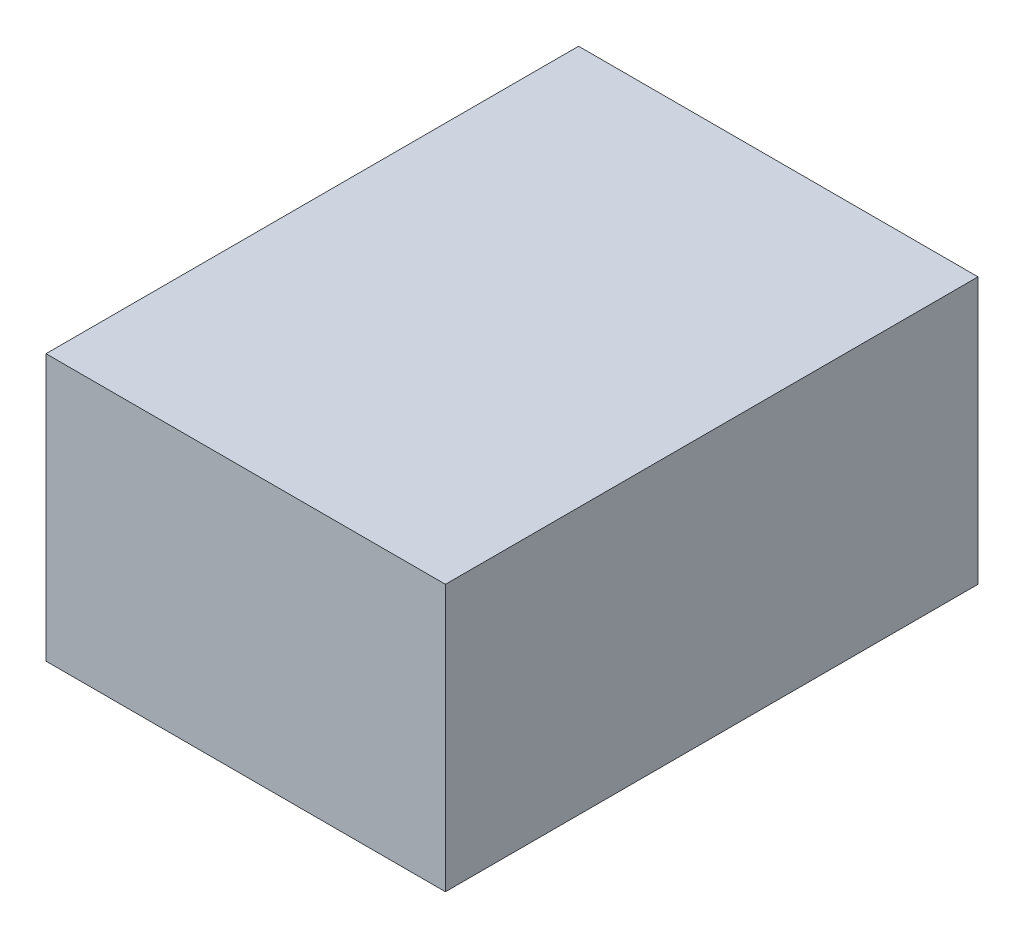
from build123d import *

# Parameters (mm, degrees)
SKETCH_1_W          = 300
SKETCH_1_H          = 200
EXTRUDE_1_DEPTH     = 200
SKETCH_2_W          = 19.471153846
SKETCH_2_H          = 15.044070513
CUT_EXTRUDE_1_DEPTH = 1


with BuildPart() as part:
    # 草图1 → 凸台-拉伸1 (new, symmetric)
    with BuildSketch(Plane.XY):
        Rectangle(SKETCH_1_W, SKETCH_1_H)
    extrude(amount=EXTRUDE_1_DEPTH, both=True)

    # 草图2 → 切除-拉伸1 (cut)
    # profile 1 of 11: a face of its own
    with BuildSketch(Plane.ZY.offset(150)):
        with BuildLine():
            Line((-75.450721154, -9.787660256), (-51.652644231, -9.787660256))
            Line((-51.652644231, -9.787660256), (-48.407451923, -6.542467949))
            Line((-48.407451923, -6.542467949), (-43.539663462, -11.41025641))
            Line((-43.539663462, -11.41025641), (-58.413461538, -11.41025641))
            Line((-58.413461538, -11.41025641), (-58.413461538, -29.659455128))
            Line((-58.413461538, -29.659455128), (-46.243990385, -29.659455128))
            Line((-46.243990385, -29.659455128), (-42.728365385, -26.143830128))
            Line((-42.728365385, -26.143830128), (-37.590144231, -31.282051282))
            Line((-37.590144231, -31.282051282), (-71.935096154, -31.282051282))
            add(Edge.make_bspline(
                [(-71.935096154, -31.282051282), (-72.509677745, -31.291432943), (-73.637496074, -31.309847751), (-75.297671202, -31.461870865), (-76.890613511, -31.718813935), (-77.919410993, -31.969859163), (-78.425480769, -32.093349359)],
                knots=[0, 0, 0, 0, 1.051078301, 2.063110603, 3.047236021, 4, 4, 4, 4], degree=3))
            Line((-78.425480769, -32.093349359), (-80.859375, -29.659455128))
            Line((-80.859375, -29.659455128), (-62.199519231, -29.659455128))
            Line((-62.199519231, -29.659455128), (-62.199519231, -11.41025641))
            Line((-62.199519231, -11.41025641), (-70.3125, -11.41025641))
            Line((-70.3125, -11.41025641), (-73.287259615, -11.951121795))
            Line((-73.287259615, -11.951121795), (-75.450721154, -9.787660256))
        make_face()
    # profile 2 of 11: a face of its own
    with BuildSketch(Plane.ZY.offset(150)):
        with BuildLine():
            add(Edge.make_bspline(
                [(-63.010817308, 3.313301282), (-63.70196555, 2.665342126), (-65.055789436, 1.396117192), (-67.101920987, -0.409024252), (-69.110744006, -2.081594188), (-71.088024242, -3.618739462), (-73.031231691, -5.023676297), (-74.94109794, -6.295252031), (-76.816370054, -7.437215951), (-78.078317117, -8.107473192), (-78.695913462, -8.435496795)],
                knots=[0, 0, 0, 0, 1.156336434, 2.26503634, 3.329987673, 4.346491992, 5.321449847, 6.25617807, 7.146574306, 8, 8, 8, 8], degree=3))
            Line((-78.695913462, -8.435496795), (-79.236778846, -7.634214744))
            add(Edge.make_bspline(
                [(-79.236778846, -7.634214744), (-78.466612119, -7.013211807), (-76.94716156, -5.788044287), (-74.798431552, -3.862344293), (-72.786159979, -1.907681593), (-70.9283371, 0.087261462), (-69.193348519, 2.098242314), (-67.624658478, 4.158001254), (-66.177926926, 6.239812834), (-65.326128482, 7.678293836), (-64.903846154, 8.391426282)],
                knots=[0, 0, 0, 0, 1.097558762, 2.165357468, 3.200105271, 4.20915088, 5.189137413, 6.145661431, 7.080704579, 8, 8, 8, 8], degree=3))
            Line((-64.903846154, 8.391426282), (-60.306490385, 4.114583333))
            Line((-60.306490385, 4.114583333), (-63.010817308, 3.313301282))
        make_face()
    # profile 3 of 11: a face of its own
    with BuildSketch(Plane.ZY.offset(150)):
        with BuildLine():
            Line((-56.790865385, 5.426682692), (-56.25, 6.227964744))
            add(Edge.make_bspline(
                [(-56.25, 6.227964744), (-55.602013201, 5.968288295), (-54.353765393, 5.468061196), (-52.561921114, 4.736310179), (-50.939784526, 4.014935701), (-49.466067329, 3.364571381), (-48.159257951, 2.734189121), (-47.020604624, 2.126839151), (-46.023607961, 1.588926724), (-45.188639348, 1.056551314), (-44.475056656, 0.550255631), (-43.856984613, 0.050625612), (-43.336392245, -0.461096037), (-42.895700421, -0.97242665), (-42.557197401, -1.498201373), (-42.283675047, -2.019424407), (-42.126252176, -2.557957207), (-42.025171716, -3.246440506), (-42.036704675, -4.053274649), (-42.150719623, -4.932592671), (-42.419038065, -5.69226447), (-42.834698578, -6.278936389), (-43.261573998, -6.718303712), (-43.600840751, -7.050337487), (-43.852393158, -7.27820396), (-44.018844643, -7.333335264), (-44.080528846, -7.353766026)],
                knots=[0, 0, 0, 0, 2.222387381, 4.281090571, 6.16104692, 7.873717546, 9.409149256, 10.778394997, 11.982114518, 13.014137748, 13.928452118, 14.766772039, 15.540917158, 16.249939126, 16.910287843, 17.528216072, 18.116646233, 18.686347911, 19.738588089, 20.67355028, 21.50081465, 22.273206655, 22.942476537, 23.446079015, 23.794725926, 24, 24, 24, 24], degree=3))
            add(Edge.make_bspline(
                [(-44.080528846, -7.353766026), (-44.175859193, -7.343044478), (-44.380619318, -7.320015658), (-44.678917095, -7.144088262), (-44.998614522, -6.89875826), (-45.316223469, -6.529817279), (-45.665278329, -6.085597905), (-46.027524829, -5.534711555), (-46.405001357, -4.884293922), (-46.653226834, -4.410106054), (-46.784855769, -4.158653846)],
                knots=[0, 0, 0, 0, 0.527544467, 1.133113159, 1.886286847, 2.76587534, 3.823244141, 5.026973888, 6.423464563, 8, 8, 8, 8], degree=3))
            add(Edge.make_bspline(
                [(-46.784855769, -4.158653846), (-46.989047869, -3.814065973), (-47.420787522, -3.085476333), (-48.239652361, -2.011437907), (-49.229647584, -0.886631945), (-50.400133133, 0.283507751), (-51.736166033, 1.511385737), (-53.262058618, 2.773753173), (-54.955406846, 4.101113011), (-56.163369895, 4.973504929), (-56.790865385, 5.426682692)],
                knots=[0, 0, 0, 0, 0.688371872, 1.455479582, 2.318090961, 3.264097909, 4.300380693, 5.437681015, 6.668962925, 8, 8, 8, 8], degree=3))
        make_face()
    # profile 4 of 11: a face of its own
    with BuildSketch(Plane.ZY.offset(150)):
        with BuildLine():
            Line((-47.325721154, 5.446714744), (-44.891826923, 11.666666667))
            Line((-44.891826923, 11.666666667), (-72.205528846, 11.666666667))
            add(Edge.make_bspline(
                [(-72.205528846, 11.666666667), (-72.209545167, 11.279296402), (-72.217131374, 10.547614202), (-72.268562392, 9.505548418), (-72.342238873, 8.581714154), (-72.457335153, 7.773120501), (-72.627824299, 7.066031142), (-72.963412456, 6.490892686), (-73.401577134, 6.016481735), (-73.955281564, 5.712724387), (-74.493605098, 5.479308102), (-74.980823455, 5.327392286), (-75.374003207, 5.196892528), (-75.616967012, 5.182467666), (-75.721153846, 5.176282051)],
                knots=[0, 0, 0, 0, 1.659337105, 3.134229793, 4.469274937, 5.626275952, 6.636097599, 7.558581424, 8.448790264, 9.366159641, 10.237556677, 10.961212527, 11.554551027, 12, 12, 12, 12], degree=3))
            add(Edge.make_bspline(
                [(-75.721153846, 5.176282051), (-75.926977026, 5.200863862), (-76.398676686, 5.25719975), (-76.960801227, 5.507780864), (-77.402148443, 5.758829992), (-77.660400273, 5.930881929), (-77.838501226, 6.088857197), (-77.871346218, 6.209338958), (-77.884615385, 6.258012821)],
                knots=[0, 0, 0, 0, 1.48119583, 3.394562111, 4.36050321, 5.118249749, 5.643778524, 6, 6, 6, 6], degree=3))
            add(Edge.make_bspline(
                [(-77.884615385, 6.258012821), (-77.859171349, 6.417580582), (-77.79749553, 6.804369564), (-77.441174029, 7.405199141), (-76.941475815, 8.154965154), (-76.505565534, 8.672942155), (-76.262019231, 8.962339744)],
                knots=[0, 0, 0, 0, 0.602804915, 1.46118676, 2.581546234, 4, 4, 4, 4], degree=3))
            add(Edge.make_bspline(
                [(-76.262019231, 8.962339744), (-76.084382658, 9.196576078), (-75.721882707, 9.674578205), (-75.245623444, 10.45729072), (-74.813160733, 11.305417058), (-74.423295069, 12.219503302), (-74.073048646, 13.203164758), (-73.766630319, 14.254088874), (-73.489992251, 15.368698066), (-73.355942792, 16.139511816), (-73.287259615, 16.534455128)],
                knots=[0, 0, 0, 0, 0.857780197, 1.750457547, 2.670233957, 3.635223603, 4.649507386, 5.716600804, 6.830050396, 8, 8, 8, 8], degree=3))
            Line((-73.287259615, 16.534455128), (-72.205528846, 16.534455128))
            Line((-72.205528846, 16.534455128), (-72.205528846, 13.289262821))
            Line((-72.205528846, 13.289262821), (-44.891826923, 13.289262821))
            Line((-44.891826923, 13.289262821), (-42.728365385, 15.993589744))
            Line((-42.728365385, 15.993589744), (-38.401442308, 11.666666667))
            add(Edge.make_bspline(
                [(-38.401442308, 11.666666667), (-38.684354377, 11.642102561), (-39.278842727, 11.590485553), (-40.181290416, 11.248828137), (-41.121737421, 10.709676261), (-42.105858217, 9.949262777), (-43.146231281, 8.993311791), (-44.234615058, 7.823172057), (-45.377245387, 6.448093207), (-46.122434307, 5.437465723), (-46.514423077, 4.905849359)],
                knots=[0, 0, 0, 0, 0.624762377, 1.31282471, 2.108641581, 3.014257539, 4.053041353, 5.226914023, 6.54128459, 8, 8, 8, 8], degree=3))
            Line((-46.514423077, 4.905849359), (-47.325721154, 5.446714744))
        make_face()
    # profile 5 of 11: a face of its own
    with BuildSketch(Plane.ZY.offset(150)):
        with BuildLine():
            Line((-65.715144231, 23.966346154), (-65.174278846, 24.787660256))
            add(Edge.make_bspline(
                [(-65.174278846, 24.787660256), (-64.720112317, 24.587588037), (-63.84745463, 24.203159531), (-62.595153612, 23.646788285), (-61.460496178, 23.114337858), (-60.443133968, 22.614741677), (-59.535539849, 22.155492813), (-58.747094308, 21.722625205), (-58.062858127, 21.338660886), (-57.491118298, 20.971130105), (-57.004882612, 20.621727901), (-56.61479634, 20.245340599), (-56.281679404, 19.865029693), (-56.041759863, 19.45207644), (-55.879960122, 19.024950509), (-55.783226658, 18.582633626), (-55.777931626, 18.121375813), (-55.861986862, 17.514528961), (-56.047037646, 16.831415279), (-56.285523344, 16.120913458), (-56.568196031, 15.572602072), (-56.982235956, 15.112619977), (-57.503021253, 14.757853143), (-57.948790535, 14.676761108), (-58.143028846, 14.641426282)],
                knots=[0, 0, 0, 0, 1.971005274, 3.78718552, 5.442142868, 6.948379248, 8.288584754, 9.481213346, 10.520635333, 11.403371319, 12.180389358, 12.893209359, 13.55193343, 14.181869875, 14.777815506, 15.360333856, 15.970420313, 16.598679906, 17.7885781, 18.774169935, 19.5752527, 20.213920393, 21.22173846, 22, 22, 22, 22], degree=3))
            add(Edge.make_bspline(
                [(-58.143028846, 14.641426282), (-58.281974993, 14.670620993), (-58.602457106, 14.737959188), (-59.012182436, 15.159056904), (-59.405630128, 15.77512536), (-59.635732007, 16.279680672), (-59.765625, 16.564503205)],
                knots=[0, 0, 0, 0, 0.637804645, 1.47110939, 2.572435941, 4, 4, 4, 4], degree=3))
            add(Edge.make_bspline(
                [(-59.765625, 16.564503205), (-59.89309552, 16.803112562), (-60.165515822, 17.313050337), (-60.657759207, 18.088922378), (-61.253370857, 18.921714766), (-61.950493522, 19.812548005), (-62.735175214, 20.776707493), (-63.647731109, 21.779928888), (-64.63049822, 22.869734565), (-65.344837056, 23.591953831), (-65.715144231, 23.966346154)],
                knots=[0, 0, 0, 0, 0.681165141, 1.455734343, 2.312029879, 3.258982338, 4.304417023, 5.441970212, 6.673939121, 8, 8, 8, 8], degree=3))
        make_face()
    # profile 6 of 11: a face of its own
    with BuildSketch(Plane.ZY.offset(150)):
        with BuildLine():
            Line((-77.073317308, -1.344150641), (-85.997596154, -6.752804487))
            Line((-85.997596154, -6.752804487), (-85.997596154, -30.290464744))
            add(Edge.make_bspline(
                [(-85.997596154, -30.290464744), (-86.034019862, -30.642744359), (-86.105819984, -31.337174462), (-86.392147372, -32.342479048), (-86.832323572, -33.283432273), (-87.40391225, -34.170825289), (-88.131750366, -34.99086706), (-88.995220091, -35.751987297), (-90.008977617, -36.44585744), (-90.751140028, -36.844603946), (-91.135817308, -37.051282051)],
                knots=[0, 0, 0, 0, 0.951282364, 1.875212421, 2.79533767, 3.736905861, 4.704203426, 5.734873166, 6.825940502, 8, 8, 8, 8], degree=3))
            add(Edge.make_bspline(
                [(-91.135817308, -37.051282051), (-91.163025739, -36.79953398), (-91.220206246, -36.27046701), (-91.660060627, -35.514626358), (-92.342638066, -34.797134968), (-93.277495683, -34.08427096), (-94.464481398, -33.379256368), (-95.920512338, -32.699250749), (-97.623995282, -32.005798102), (-98.862156832, -31.591864124), (-99.519230769, -31.372195513)],
                knots=[0, 0, 0, 0, 0.567410724, 1.192455101, 1.93008711, 2.801753461, 3.841774178, 5.047670883, 6.433242804, 8, 8, 8, 8], degree=3))
            Line((-99.519230769, -31.372195513), (-99.519230769, -30.290464744))
            add(Edge.make_bspline(
                [(-99.519230769, -30.290464744), (-99.045341389, -30.375061439), (-98.138642048, -30.536921508), (-96.840643769, -30.75034827), (-95.667788187, -30.909130959), (-94.626098494, -31.031404794), (-93.711065449, -31.114159691), (-92.922505648, -31.155984562), (-92.256779012, -31.161386267), (-91.703259208, -31.120737514), (-91.22978333, -31.002108065), (-90.822460147, -30.766560946), (-90.503683226, -30.3944783), (-90.224950587, -29.937947908), (-90.035624757, -29.361567436), (-89.885065647, -28.687947638), (-89.798482348, -27.902114263), (-89.788799561, -27.342609539), (-89.783653846, -27.045272436)],
                knots=[0, 0, 0, 0, 1.808220358, 3.459693913, 4.940655569, 6.253580308, 7.399219139, 8.391232753, 9.218943302, 9.899057853, 10.471018597, 11.038839643, 11.633582565, 12.291719892, 13.037465463, 13.898517392, 14.883210947, 16, 16, 16, 16], degree=3))
            Line((-89.783653846, -27.045272436), (-89.783653846, -8.645833333))
            add(Edge.make_bspline(
                [(-89.783653846, -8.645833333), (-90.378604778, -8.991913183), (-91.505609913, -9.647486184), (-93.088394817, -10.591466608), (-94.455091648, -11.462800897), (-95.605537517, -12.253398503), (-96.55726479, -12.948128297), (-97.285806814, -13.569663064), (-97.836227203, -14.087288139), (-98.068567221, -14.451121966), (-98.167067308, -14.60536859)],
                knots=[0, 0, 0, 0, 1.596009153, 3.023292197, 4.273176395, 5.353314463, 6.260656545, 7.002131711, 7.576955733, 8, 8, 8, 8], degree=3))
            Line((-98.167067308, -14.60536859), (-101.412259615, -9.727564103))
            add(Edge.make_bspline(
                [(-101.412259615, -9.727564103), (-101.114404175, -9.649937782), (-100.460903896, -9.479624217), (-99.410362152, -9.14243811), (-98.200367401, -8.718923382), (-96.828090574, -8.217844081), (-95.29376289, -7.632877124), (-93.594081912, -6.977476087), (-91.739148303, -6.222335449), (-90.454180609, -5.682394881), (-89.783653846, -5.400641026)],
                knots=[0, 0, 0, 0, 0.594885919, 1.30519058, 2.131778393, 3.072962133, 4.12892683, 5.305816866, 6.59411104, 8, 8, 8, 8], degree=3))
            Line((-89.783653846, -5.400641026), (-89.783653846, 9.743589744))
            Line((-89.783653846, 9.743589744), (-95.462740385, 9.743589744))
            Line((-95.462740385, 9.743589744), (-98.707932692, 9.202724359))
            Line((-98.707932692, 9.202724359), (-100.871394231, 11.366185897))
            Line((-100.871394231, 11.366185897), (-89.783653846, 11.366185897))
            add(Edge.make_bspline(
                [(-89.783653846, 11.366185897), (-89.781657912, 12.16413824), (-89.777791236, 13.709992045), (-89.804795956, 15.953522225), (-89.82075086, 18.050280461), (-89.849747217, 20.003488977), (-89.894442704, 21.812870524), (-89.925763787, 23.476028778), (-89.991908399, 24.99142039), (-90.034042027, 25.952862937), (-90.054086538, 26.41025641)],
                knots=[0, 0, 0, 0, 1.272643643, 2.465461797, 3.57841033, 4.61688262, 5.580919197, 6.465104001, 7.269793692, 8, 8, 8, 8], degree=3))
            Line((-90.054086538, 26.41025641), (-83.293269231, 23.405448718))
            Line((-83.293269231, 23.405448718), (-85.997596154, 21.211939103))
            Line((-85.997596154, 21.211939103), (-85.997596154, 11.366185897))
            Line((-85.997596154, 11.366185897), (-83.834134615, 11.366185897))
            Line((-83.834134615, 11.366185897), (-81.129807692, 14.070512821))
            Line((-81.129807692, 14.070512821), (-76.802884615, 9.743589744))
            Line((-76.802884615, 9.743589744), (-85.997596154, 9.743589744))
            Line((-85.997596154, 9.743589744), (-85.997596154, -4.048477564))
            Line((-85.997596154, -4.048477564), (-77.614182692, -0.262419872))
            Line((-77.614182692, -0.262419872), (-77.073317308, -1.344150641))
        make_face()
    # profile 7 of 11: a face of its own
    with BuildSketch(Plane.ZY.offset(150)):
        with BuildLine():
            add(Edge.make_bspline(
                [(10.817307692, -21.095753205), (10.837451535, -20.588282839), (10.880253502, -19.510001523), (10.945816819, -17.797557633), (10.977223011, -15.8907371), (11.021781798, -13.794202363), (11.050804759, -11.507135627), (11.066485432, -9.029778816), (11.094447013, -6.362226635), (11.084306308, -3.554353152), (11.094395257, -0.716434405), (11.066014381, 2.054615289), (11.050556573, 4.702241831), (11.021196781, 7.226336136), (10.976236055, 9.626703859), (10.944824841, 11.904028871), (10.878017368, 14.060523245), (10.837153532, 15.456060568), (10.817307692, 16.133814103)],
                knots=[0, 0, 0, 0, 0.654692731, 1.391101799, 2.209012074, 3.112981841, 4.094341678, 5.15742433, 6.306581118, 7.533174739, 8.776983709, 9.964873981, 11.105423337, 12.19006718, 13.218828337, 14.200254234, 15.125939497, 16, 16, 16, 16], degree=3))
            Line((10.817307692, 16.133814103), (16.496394231, 13.419471154))
            Line((16.496394231, 13.419471154), (14.332932692, 11.786858974))
            Line((14.332932692, 11.786858974), (14.332932692, -13.213141026))
            add(Edge.make_bspline(
                [(14.332932692, -13.213141026), (14.33810291, -13.570420178), (14.349558248, -14.362021886), (14.405236136, -15.670779173), (14.481772165, -17.217093882), (14.560997979, -18.328129625), (14.603365385, -18.922275641)],
                knots=[0, 0, 0, 0, 0.750054126, 1.661849349, 2.749632581, 4, 4, 4, 4], degree=3))
            Line((14.603365385, -18.922275641), (10.817307692, -21.095753205))
        make_face()
    # profile 8 of 11: a face of its own
    with BuildSketch(Plane.ZY.offset(150)):
        with BuildLine():
            add(Edge.make_bspline(
                [(23.257211538, 18.006810897), (23.245369241, 19.429460299), (23.222034128, 22.232774805), (23.064410381, 25.031735572), (22.986778846, 26.41025641)],
                knots=[0, 0, 0, 0, 1.014976663, 2, 2, 2, 2], degree=3))
            Line((22.986778846, 26.41025641), (28.665865385, 23.695913462))
            Line((28.665865385, 23.695913462), (26.772836538, 21.802884615))
            Line((26.772836538, 21.802884615), (26.772836538, -28.918269231))
            add(Edge.make_bspline(
                [(26.772836538, -28.918269231), (26.780025712, -29.376421468), (26.793960716, -30.264472535), (26.586334197, -31.547269832), (26.217685143, -32.735156997), (25.650150156, -33.814591798), (24.901978321, -34.788866237), (23.991587485, -35.673130483), (22.885935071, -36.435634042), (22.061075896, -36.841463915), (21.634615385, -37.051282051)],
                knots=[0, 0, 0, 0, 1.065221631, 2.064752996, 3.011361688, 3.950276852, 4.887903625, 5.861084974, 6.894159364, 8, 8, 8, 8], degree=3))
            add(Edge.make_bspline(
                [(21.634615385, -37.051282051), (21.565539848, -36.698279914), (21.427859216, -35.994679769), (20.893714976, -35.023236592), (20.119846793, -34.162654843), (19.108047327, -33.397914121), (17.852819589, -32.74040831), (16.35777762, -32.177064154), (14.620098707, -31.699470983), (13.37024113, -31.472173079), (12.710336538, -31.352163462)],
                knots=[0, 0, 0, 0, 0.758687152, 1.512207249, 2.314469735, 3.197766889, 4.185671758, 5.308103181, 6.578722005, 8, 8, 8, 8], degree=3))
            Line((12.710336538, -31.352163462), (12.710336538, -30.270432692))
            add(Edge.make_bspline(
                [(12.710336538, -30.270432692), (13.514871089, -30.31253317), (15.023424569, -30.391474244), (17.136968817, -30.471932661), (18.947160194, -30.516947038), (20.261770559, -30.55488048), (21.164504723, -30.523681271), (21.723274451, -30.390264752), (22.207839911, -30.185056217), (22.59970633, -29.875584869), (22.897599533, -29.480511469), (23.109348572, -29.005044388), (23.241052125, -28.444505082), (23.25160323, -28.041000341), (23.257211538, -27.826522436)],
                knots=[0, 0, 0, 0, 2.369395258, 4.442766888, 6.220747348, 7.693780855, 8.31364559, 8.868590947, 9.374072957, 9.849475576, 10.318856968, 10.815389983, 11.37033534, 12, 12, 12, 12], degree=3))
            Line((23.257211538, -27.826522436), (23.257211538, 18.006810897))
        make_face()
    # profile 9 of 11: a face of its own
    with BuildSketch(Plane.ZY.offset(150)):
        with BuildLine():
            Line((-13.792067308, 12.007211538), (-13.792067308, 16.083733974))
            add(Edge.make_bspline(
                [(-13.792067308, 16.083733974), (-13.790093876, 16.61125791), (-13.786259255, 17.636301764), (-13.813163288, 19.12526309), (-13.829378984, 20.524267085), (-13.857796055, 21.826490911), (-13.903288526, 23.038135948), (-13.934149244, 24.154005992), (-14.000524456, 25.178422028), (-14.042484585, 25.829332637), (-14.0625, 26.139823718)],
                knots=[0, 0, 0, 0, 1.258249954, 2.444934331, 3.551990324, 4.595496403, 5.551660039, 6.444152705, 7.257844778, 8, 8, 8, 8], degree=3))
            Line((-14.0625, 26.139823718), (-8.383413462, 23.695913462))
            Line((-8.383413462, 23.695913462), (-10.546875, 21.79286859))
            Line((-10.546875, 21.79286859), (-10.546875, 12.007211538))
            Line((-10.546875, 12.007211538), (-4.326923077, 12.007211538))
            Line((-4.326923077, 12.007211538), (-1.352163462, 15.252403846))
            Line((-1.352163462, 15.252403846), (3.515625, 10.384615385))
            Line((3.515625, 10.384615385), (-10.546875, 10.384615385))
            Line((-10.546875, 10.384615385), (-10.546875, 2.391826923))
            Line((-10.546875, 2.391826923), (-0.811298077, 2.391826923))
            Line((-0.811298077, 2.391826923), (2.433894231, 5.637019231))
            Line((2.433894231, 5.637019231), (7.301682692, 0.769230769))
            Line((7.301682692, 0.769230769), (-10.546875, 0.769230769))
            Line((-10.546875, 0.769230769), (-10.546875, -6.582532051))
            Line((-10.546875, -6.582532051), (-1.622596154, -6.582532051))
            Line((-1.622596154, -6.582532051), (0.270432692, -3.878205128))
            Line((0.270432692, -3.878205128), (4.326923077, -6.852964744))
            Line((4.326923077, -6.852964744), (2.163461538, -8.74599359))
            Line((2.163461538, -8.74599359), (2.163461538, -21.997195513))
            add(Edge.make_bspline(
                [(2.163461538, -21.997195513), (2.171118807, -22.388814422), (2.185899115, -23.14473), (1.972400514, -24.238042824), (1.608785587, -25.247696244), (1.032317777, -26.151004243), (0.281800612, -26.951445201), (-0.631079278, -27.672919222), (-1.735575655, -28.280372991), (-2.549852223, -28.59423351), (-2.974759615, -28.758012821)],
                knots=[0, 0, 0, 0, 1.017401403, 1.963821335, 2.88272422, 3.796967302, 4.73217852, 5.728861945, 6.814870297, 8, 8, 8, 8], degree=3))
            add(Edge.make_bspline(
                [(-2.974759615, -28.758012821), (-2.949028489, -28.513499017), (-2.898183414, -28.030336238), (-3.102174518, -27.304788771), (-3.508834985, -26.625033228), (-4.14657066, -26.007134988), (-4.972898268, -25.411428943), (-6.01093984, -24.861322855), (-7.255534532, -24.338699634), (-8.167052813, -24.046351773), (-8.653846154, -23.890224359)],
                knots=[0, 0, 0, 0, 0.719770975, 1.422277761, 2.177514121, 3.034373414, 4.021596162, 5.176584016, 6.492163977, 8, 8, 8, 8], degree=3))
            Line((-8.653846154, -23.890224359), (-8.653846154, -22.80849359))
            add(Edge.make_bspline(
                [(-8.653846154, -22.80849359), (-8.026690395, -22.893236065), (-6.867441178, -23.049876018), (-5.269227155, -23.199940506), (-3.961262223, -23.32148779), (-3.048942597, -23.365095744), (-2.440003659, -23.330516205), (-2.070578523, -23.196055368), (-1.754619785, -22.976400199), (-1.505386877, -22.66871038), (-1.309623598, -22.279660546), (-1.17520633, -21.807887732), (-1.099025424, -21.251784783), (-1.087733348, -20.855622029), (-1.081730769, -20.645032051)],
                knots=[0, 0, 0, 0, 2.400940231, 4.437953482, 6.090697983, 7.383408014, 7.90526813, 8.390145591, 8.85404901, 9.348756068, 9.87566582, 10.496922005, 11.201002217, 12, 12, 12, 12], degree=3))
            Line((-1.081730769, -20.645032051), (-1.081730769, -8.205128205))
            Line((-1.081730769, -8.205128205), (-10.546875, -8.205128205))
            Line((-10.546875, -8.205128205), (-10.546875, -26.985176282))
            add(Edge.make_bspline(
                [(-10.546875, -26.985176282), (-10.542649198, -27.733077774), (-10.534441882, -29.185645444), (-10.482200475, -31.295852749), (-10.410060091, -33.270012391), (-10.319894099, -34.537448478), (-10.276442308, -35.148237179)],
                knots=[0, 0, 0, 0, 1.098589798, 2.133671401, 3.100599682, 4, 4, 4, 4], degree=3))
            Line((-10.276442308, -35.148237179), (-14.0625, -37.051282051))
            add(Edge.make_bspline(
                [(-14.0625, -37.051282051), (-14.043566477, -36.313404758), (-14.00749715, -34.907710855), (-13.938935435, -32.901571341), (-13.906354381, -31.098322489), (-13.862854021, -29.499267763), (-13.830916677, -28.103711762), (-13.816759346, -26.91499424), (-13.787736665, -25.930269035), (-13.790737532, -25.342562199), (-13.792067308, -25.08213141)],
                knots=[0, 0, 0, 0, 1.479627748, 2.818766372, 4.023746565, 5.094910282, 6.025409737, 6.82195138, 7.477970797, 8, 8, 8, 8], degree=3))
            Line((-13.792067308, -25.08213141), (-13.792067308, -8.205128205))
            Line((-13.792067308, -8.205128205), (-23.257211538, -8.205128205))
            Line((-23.257211538, -8.205128205), (-23.257211538, -27.405849359))
            Line((-23.257211538, -27.405849359), (-26.772836538, -29.298878205))
            add(Edge.make_bspline(
                [(-26.772836538, -29.298878205), (-26.729936732, -28.143784413), (-26.645390232, -25.867337347), (-26.569349397, -22.504916015), (-26.5184717, -19.24295797), (-26.494667926, -16.0844041), (-26.517290207, -13.022640835), (-26.567345308, -10.064462749), (-26.641578484, -7.205967727), (-26.729599615, -5.337085501), (-26.772836538, -4.419070513)],
                knots=[0, 0, 0, 0, 1.114655832, 2.196752345, 3.243250355, 4.260668401, 5.242671441, 6.195812807, 7.113763906, 8, 8, 8, 8], degree=3))
            Line((-26.772836538, -4.419070513), (-22.986778846, -6.582532051))
            Line((-22.986778846, -6.582532051), (-13.792067308, -6.582532051))
            Line((-13.792067308, -6.582532051), (-13.792067308, 0.769230769))
            Line((-13.792067308, 0.769230769), (-22.716346154, 0.769230769))
            add(Edge.make_bspline(
                [(-22.716346154, 0.769230769), (-23.290927745, 0.759849108), (-24.418746074, 0.7414343), (-26.078921202, 0.589411186), (-27.671863511, 0.332468116), (-28.700660993, 0.081422888), (-29.206730769, -0.042067308)],
                knots=[0, 0, 0, 0, 1.051078301, 2.063110603, 3.047236021, 4, 4, 4, 4], degree=3))
            Line((-29.206730769, -0.042067308), (-31.640625, 2.391826923))
            Line((-31.640625, 2.391826923), (-13.792067308, 2.391826923))
            Line((-13.792067308, 2.391826923), (-13.792067308, 10.384615385))
            Line((-13.792067308, 10.384615385), (-23.527644231, 10.384615385))
            add(Edge.make_bspline(
                [(-23.527644231, 10.384615385), (-23.971555809, 9.649105686), (-24.830397525, 8.226105154), (-26.187007323, 6.232812481), (-27.529988584, 4.428177524), (-28.478944767, 3.337942989), (-28.936298077, 2.8125)],
                knots=[0, 0, 0, 0, 1.105905581, 2.139610442, 3.10337765, 4, 4, 4, 4], degree=3))
            Line((-28.936298077, 2.8125), (-29.747596154, 3.082932692))
            add(Edge.make_bspline(
                [(-29.747596154, 3.082932692), (-29.31686526, 3.998050651), (-28.487865687, 5.759318317), (-27.398083134, 8.352267294), (-26.461799742, 10.768063428), (-25.696184523, 13.021233463), (-25.083882617, 15.100643606), (-24.610782088, 17.012192836), (-24.253827762, 18.751616072), (-24.127902883, 19.865333233), (-24.068509615, 20.390625)],
                knots=[0, 0, 0, 0, 1.326489263, 2.553007103, 3.688326024, 4.724181207, 5.673409887, 6.530529915, 7.306915108, 8, 8, 8, 8], degree=3))
            Line((-24.068509615, 20.390625), (-18.930288462, 17.686298077))
            add(Edge.make_bspline(
                [(-18.930288462, 17.686298077), (-19.094201515, 17.601787161), (-19.442188825, 17.42237054), (-19.924934102, 17.009087609), (-20.422970872, 16.490817712), (-20.924020504, 15.83917936), (-21.432448913, 15.064144545), (-21.953414444, 14.162496066), (-22.467578975, 13.126154282), (-22.808248092, 12.391968359), (-22.986778846, 12.007211538)],
                knots=[0, 0, 0, 0, 0.621409584, 1.319252158, 2.133225883, 3.049619521, 4.091735985, 5.264563186, 6.566469424, 8, 8, 8, 8], degree=3))
            Line((-22.986778846, 12.007211538), (-13.792067308, 12.007211538))
        make_face()
    # profile 10 of 11: a face of its own
    with BuildSketch(Plane.ZY.offset(150)):
        with BuildLine():
            add(Edge.make_bspline(
                [(91.676682692, 1.620592949), (91.674611937, 0.568903121), (91.670654448, -1.44101626), (91.697477367, -4.318910815), (91.713426669, -6.919793566), (91.741594317, -9.243608639), (91.786608921, -11.290049972), (91.817131733, -13.060064179), (91.881117632, -14.555569954), (91.926624443, -15.460095417), (91.947115385, -15.867387821)],
                knots=[0, 0, 0, 0, 1.442979407, 2.7577259, 3.948791759, 5.011646395, 5.94632697, 6.757350989, 7.440456325, 8, 8, 8, 8], degree=3))
            Line((91.947115385, -15.867387821), (87.890625, -17.489983974))
            Line((87.890625, -17.489983974), (87.890625, -13.974358974))
            Line((87.890625, -13.974358974), (68.419471154, -13.974358974))
            Line((68.419471154, -13.974358974), (68.419471154, -30.300480769))
            Line((68.419471154, -30.300480769), (91.676682692, -30.300480769))
            Line((91.676682692, -30.300480769), (95.192307692, -26.784855769))
            Line((95.192307692, -26.784855769), (100.330528846, -31.923076923))
            Line((100.330528846, -31.923076923), (68.419471154, -31.923076923))
            Line((68.419471154, -31.923076923), (66.256009615, -34.356971154))
            Line((66.256009615, -34.356971154), (62.469951923, -31.101762821))
            Line((62.469951923, -31.101762821), (64.633413462, -29.198717949))
            Line((64.633413462, -29.198717949), (64.633413462, 5.15625))
            add(Edge.make_bspline(
                [(64.633413462, 5.15625), (64.629215786, 6.655334503), (64.621081967, 9.560104579), (64.568681543, 13.780271351), (64.496495334, 17.727082871), (64.406425328, 20.267188074), (64.362980769, 21.492387821)],
                knots=[0, 0, 0, 0, 1.100965592, 2.133336647, 3.099629627, 4, 4, 4, 4], degree=3))
            Line((64.362980769, 21.492387821), (68.689903846, 19.05849359))
            Line((68.689903846, 19.05849359), (89.783653846, 19.05849359))
            Line((89.783653846, 19.05849359), (92.758413462, 22.033253205))
            Line((92.758413462, 22.033253205), (97.355769231, 17.435897436))
            Line((97.355769231, 17.435897436), (68.419471154, 17.435897436))
            Line((68.419471154, 17.435897436), (68.419471154, 4.314903846))
            Line((68.419471154, 4.314903846), (87.620192308, 4.314903846))
            Line((87.620192308, 4.314903846), (90.054086538, 6.748798077))
            Line((90.054086538, 6.748798077), (94.110576923, 3.243189103))
            Line((94.110576923, 3.243189103), (91.676682692, 1.620592949))
        make_face()
        with Locations((78.155048077, -4.829727565)):
            Rectangle(SKETCH_2_W, SKETCH_2_H, mode=Mode.SUBTRACT)
    # profile 11 of 11: a face of its own
    with BuildSketch(Plane.ZY.offset(150)):
        with BuildLine():
            add(Edge.make_bspline(
                [(52.734375, -1.183894231), (52.734653822, -2.355768796), (52.735197166, -4.639421795), (52.731355252, -7.971430966), (52.744742483, -11.119791772), (52.754014168, -14.084536052), (52.76383004, -16.865654783), (52.774993378, -19.463136422), (52.780988762, -21.87704755), (52.804265799, -24.110581177), (52.823490036, -26.160532629), (52.843251555, -28.026860024), (52.864490678, -29.70953051), (52.880044905, -31.208741908), (52.912954042, -32.524085747), (52.942269783, -33.655915041), (52.970934639, -34.604170576), (52.994384092, -35.174961544), (53.004807692, -35.428685897)],
                knots=[0, 0, 0, 0, 1.642468092, 3.200707051, 4.670044933, 6.055154134, 7.356034714, 8.568007383, 9.695751593, 10.739298929, 11.698620817, 12.569038838, 13.355233118, 14.057204948, 14.670366581, 15.199324675, 15.644088922, 16, 16, 16, 16], degree=3))
            Line((53.004807692, -35.428685897), (48.677884615, -37.051282051))
            add(Edge.make_bspline(
                [(48.677884615, -37.051282051), (48.697782865, -35.982905362), (48.738946905, -33.772726068), (48.805275393, -30.354096609), (48.837051316, -26.724742008), (48.881765736, -22.888688653), (48.911114465, -18.838841197), (48.926873979, -14.578656039), (48.954080716, -10.108201156), (48.950267672, -7.059967042), (48.948317308, -5.500801282)],
                knots=[0, 0, 0, 0, 0.812796831, 1.681454436, 2.600825388, 3.57352368, 4.599527634, 5.681385186, 6.814033078, 8, 8, 8, 8], degree=3))
            add(Edge.make_bspline(
                [(48.948317308, -5.500801282), (48.602330918, -6.302396491), (47.910135506, -7.906102713), (46.732189608, -10.24018763), (45.469092649, -12.526339376), (44.095602906, -14.74700611), (42.622579726, -16.913148807), (41.046921007, -19.017181473), (39.377039268, -21.066531406), (38.187231632, -22.373142607), (37.590144231, -23.028846154)],
                knots=[0, 0, 0, 0, 0.997783246, 1.996208538, 2.987019417, 3.9825815, 4.979693074, 5.980333173, 6.986460012, 8, 8, 8, 8], degree=3))
            Line((37.590144231, -23.028846154), (37.049278846, -22.217548077))
            add(Edge.make_bspline(
                [(37.049278846, -22.217548077), (37.751389356, -21.088932517), (39.152846548, -18.836144144), (41.053995847, -15.346658409), (42.765109681, -11.775094507), (44.307928714, -8.135100532), (45.692272724, -4.423857845), (46.861560529, -0.623612984), (47.888953375, 3.24268456), (48.414322665, 5.864301111), (48.677884615, 7.179487179)],
                knots=[0, 0, 0, 0, 1.00267425, 2.001401517, 2.996223543, 3.98947534, 4.983314668, 5.983188006, 6.988226163, 8, 8, 8, 8], degree=3))
            Line((48.677884615, 7.179487179), (42.1875, 7.179487179))
            Line((42.1875, 7.179487179), (39.753605769, 6.638621795))
            Line((39.753605769, 6.638621795), (37.590144231, 8.802083333))
            Line((37.590144231, 8.802083333), (48.948317308, 8.802083333))
            add(Edge.make_bspline(
                [(48.948317308, 8.802083333), (48.944028528, 10.428034821), (48.935635703, 13.609901332), (48.883066487, 18.277440312), (48.810042046, 22.734972115), (48.721225184, 25.63576326), (48.677884615, 27.051282051)],
                knots=[0, 0, 0, 0, 1.069003844, 2.091961266, 3.068921358, 4, 4, 4, 4], degree=3))
            Line((48.677884615, 27.051282051), (54.897836538, 23.735977564))
            Line((54.897836538, 23.735977564), (52.734375, 22.073317308))
            Line((52.734375, 22.073317308), (52.734375, 8.802083333))
            Line((52.734375, 8.802083333), (56.25, 8.802083333))
            Line((56.25, 8.802083333), (59.224759615, 11.776842949))
            Line((59.224759615, 11.776842949), (63.822115385, 7.179487179))
            Line((63.822115385, 7.179487179), (52.734375, 7.179487179))
            Line((52.734375, 7.179487179), (52.734375, 0.168269231))
            add(Edge.make_bspline(
                [(52.734375, 0.168269231), (53.189283578, -0.070519232), (54.059671857, -0.527399337), (55.296925691, -1.209071429), (56.407183826, -1.860131881), (57.399587627, -2.47029245), (58.271799403, -3.036174622), (59.015405634, -3.56953258), (59.644121549, -4.05651526), (60.290138616, -4.652853738), (60.928710423, -5.364931441), (61.493380735, -6.221589741), (61.859563117, -7.071971334), (61.90651102, -7.647789653), (61.929086538, -7.924679487)],
                knots=[0, 0, 0, 0, 1.453075962, 2.780207596, 3.994837529, 5.092876958, 6.075011437, 6.934507172, 7.680721684, 8.322271477, 9.419336026, 10.37533935, 11.218760496, 12, 12, 12, 12], degree=3))
            add(Edge.make_bspline(
                [(61.929086538, -7.924679487), (61.916758375, -8.078962218), (61.8884686, -8.432999054), (61.722828243, -9.017085524), (61.454274633, -9.714041647), (61.129691667, -10.482568224), (60.775022512, -11.206024005), (60.423072965, -11.750431293), (60.119019665, -12.140055879), (59.867115469, -12.21242822), (59.765625, -12.241586538)],
                knots=[0, 0, 0, 0, 0.743821384, 1.706867436, 2.907255612, 4.340487871, 5.728005349, 6.762463537, 7.501405065, 8, 8, 8, 8], degree=3))
            add(Edge.make_bspline(
                [(59.765625, -12.241586538), (59.693526566, -12.23372192), (59.538130501, -12.216771056), (59.324086928, -12.060132429), (59.090200172, -11.853931161), (58.870173262, -11.543832896), (58.620936988, -11.168357628), (58.377750415, -10.699819708), (58.130576188, -10.144125154), (57.962127967, -9.74787193), (57.872596154, -9.537259615)],
                knots=[0, 0, 0, 0, 0.501059994, 1.07995066, 1.809941644, 2.69597025, 3.729662908, 4.977424325, 6.393472606, 8, 8, 8, 8], degree=3))
            add(Edge.make_bspline(
                [(57.872596154, -9.537259615), (57.575306867, -8.819935682), (56.970026684, -7.359466097), (55.795458638, -5.247698472), (54.384670658, -3.167907726), (53.29350059, -1.85608452), (52.734375, -1.183894231)],
                knots=[0, 0, 0, 0, 0.944768207, 1.923545508, 2.936005599, 4, 4, 4, 4], degree=3))
        make_face()
    extrude(amount=-CUT_EXTRUDE_1_DEPTH, mode=Mode.SUBTRACT)


solid = part.part
